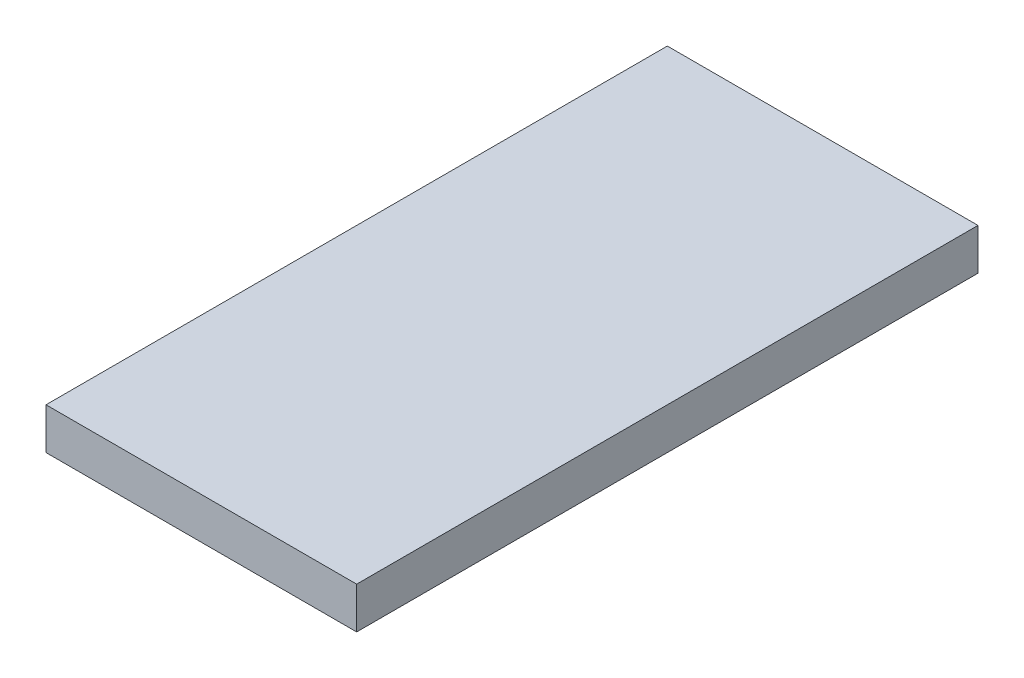
from build123d import *

# Parameters (mm, degrees)
SKETCH1_W                                    = 60
SKETCH1_H                                    = 8
BOSS_EXTRUDE1_DEPTH                          = 120
CBORE_FOR_M3_HEX_SOCKET_HEAD_CAP_SCR_2_COUNT = 2
CBORE_FOR_M3_HEX_SOCKET_HEAD_CAP_SCR_2_PITCH = 40
CBORE_FOR_M3_HEX_SOCKET_HEAD_CAP_SCR_3_COUNT = 2
CBORE_FOR_M3_HEX_SOCKET_HEAD_CAP_SCR_3_PITCH = 60
CBORE_FOR_M3_HEX_SOCKET_HEAD_CAP_SCR_4_COUNT = 2
CBORE_FOR_M3_HEX_SOCKET_HEAD_CAP_SCR_4_PITCH = 80
CBORE_FOR_M3_HEX_SOCKET_HEAD_CAP_SCR_5_COUNT = 2
CBORE_FOR_M3_HEX_SOCKET_HEAD_CAP_SCR_5_PITCH = 20


with BuildPart() as part:
    # Sketch1 → Boss-Extrude1 (new body)
    with BuildSketch(Plane.XY):
        with Locations((30, 4)):
            Rectangle(SKETCH1_W, SKETCH1_H)
    extrude(amount=BOSS_EXTRUDE1_DEPTH)

    # Sketch4 → CBORE for M3 Hex Socket Head Cap Screw1 (revolve, cut)
    with BuildSketch(Plane(origin=(17.101413203, 0, 100), x_dir=(0, 0, -1), z_dir=(1, 0, 0))):
        Polygon((0, 0), (0, 7.021463052), (1.7, 6), (1.7, 3.4), (3.25, 3.4), (3.25, 0.025), (3.275, 0), align=None)
    cbore_for_m3_hex_socket_head_cap_screw1 = revolve(axis=Axis((17.101413203, -6.35, 100), (0, 1, 0)), mode=Mode.SUBTRACT)

    # CBORE for M3 Hex Socket Head Cap Scr 2: CBORE for M3 Hex Socket Head Cap Screw1 ×2
    with Locations(*[(0, 0, -i * CBORE_FOR_M3_HEX_SOCKET_HEAD_CAP_SCR_2_PITCH) for i in range(1, CBORE_FOR_M3_HEX_SOCKET_HEAD_CAP_SCR_2_COUNT)]):
        add(cbore_for_m3_hex_socket_head_cap_screw1, mode=Mode.SUBTRACT)

    # CBORE for M3 Hex Socket Head Cap Scr 3: CBORE for M3 Hex Socket Head Cap Screw1 ×2
    with Locations(*[(0, 0, -i * CBORE_FOR_M3_HEX_SOCKET_HEAD_CAP_SCR_3_PITCH) for i in range(1, CBORE_FOR_M3_HEX_SOCKET_HEAD_CAP_SCR_3_COUNT)]):
        add(cbore_for_m3_hex_socket_head_cap_screw1, mode=Mode.SUBTRACT)

    # CBORE for M3 Hex Socket Head Cap Scr 4: CBORE for M3 Hex Socket Head Cap Screw1 ×2
    with Locations(*[(0, 0, -i * CBORE_FOR_M3_HEX_SOCKET_HEAD_CAP_SCR_4_PITCH) for i in range(1, CBORE_FOR_M3_HEX_SOCKET_HEAD_CAP_SCR_4_COUNT)]):
        add(cbore_for_m3_hex_socket_head_cap_screw1, mode=Mode.SUBTRACT)

    # CBORE for M3 Hex Socket Head Cap Scr 5: CBORE for M3 Hex Socket Head Cap Screw1 ×2
    with Locations(*[(0, 0, -i * CBORE_FOR_M3_HEX_SOCKET_HEAD_CAP_SCR_5_PITCH) for i in range(1, CBORE_FOR_M3_HEX_SOCKET_HEAD_CAP_SCR_5_COUNT)]):
        add(cbore_for_m3_hex_socket_head_cap_screw1, mode=Mode.SUBTRACT)


solid = part.part
